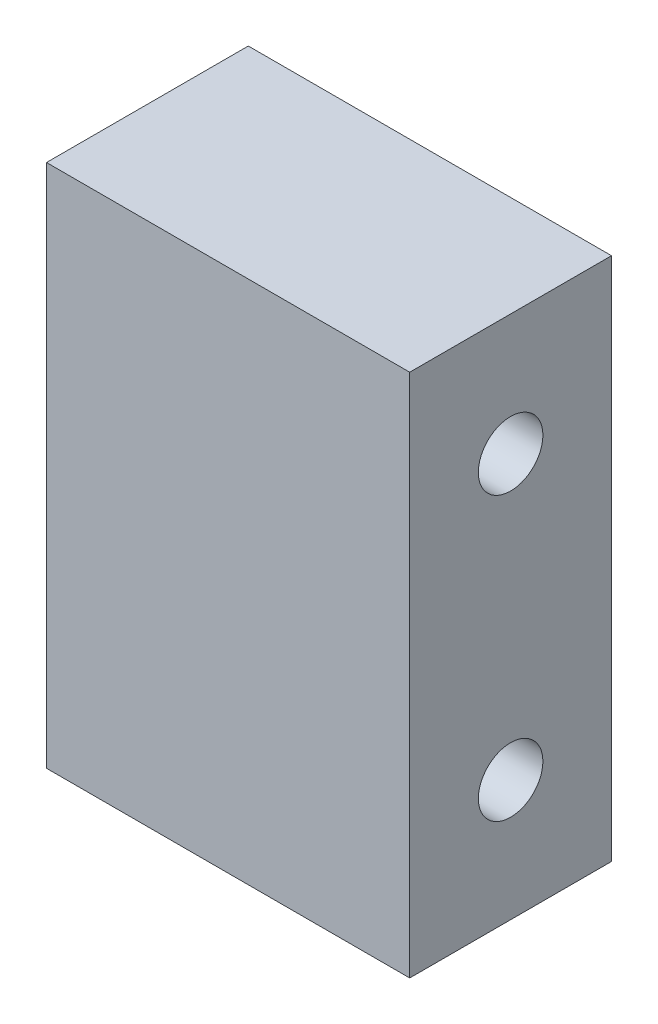
from build123d import *

# Parameters (mm, degrees)
SKETCH1_W           = 45
SKETCH1_H           = 65
BOSS_EXTRUDE1_DEPTH = 25
SKETCH2_R           = 4
CUT_EXTRUDE1_DEPTH  = 25


with BuildPart() as part:
    # Sketch1 → Boss-Extrude1 (new body)
    with BuildSketch(Plane.XY):
        with Locations((22.5, 32.5)):
            Rectangle(SKETCH1_W, SKETCH1_H)
    extrude(amount=BOSS_EXTRUDE1_DEPTH)

    # Sketch2 → Cut-Extrude1 (cut)
    with BuildSketch(Plane(origin=(45, 0, 0), x_dir=(0, 0, -1), z_dir=(1, 0, 0))):
        with Locations((-12.5, 50)):
            Circle(SKETCH2_R)
        with Locations((-12.5, 15)):
            Circle(SKETCH2_R)
    extrude(amount=-CUT_EXTRUDE1_DEPTH, mode=Mode.SUBTRACT)


solid = part.part
